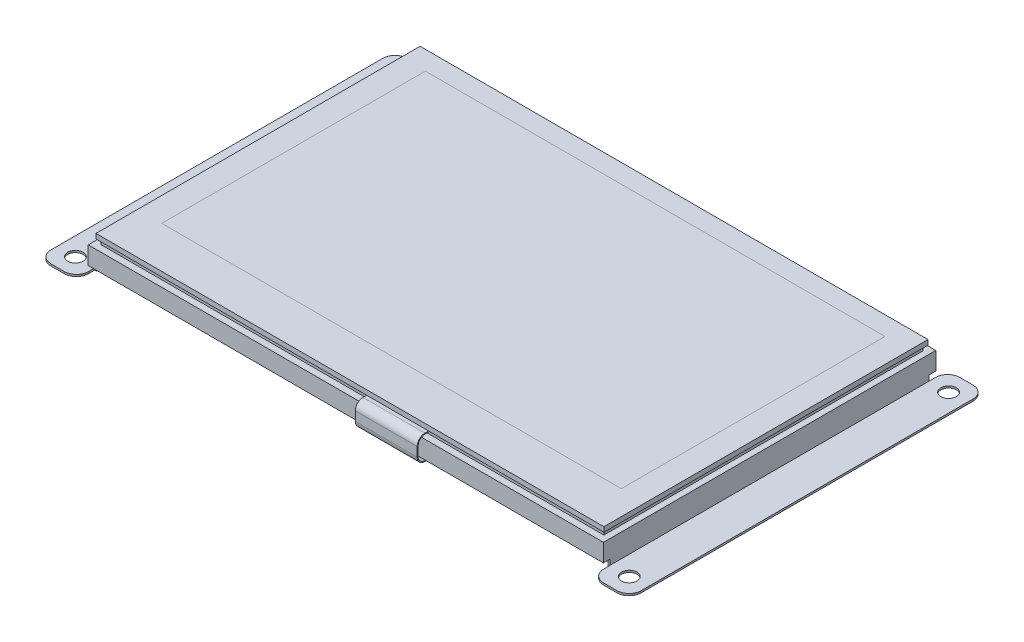
from build123d import *

# Parameters (mm, degrees)
SKETCH_1_W       = 105
SKETCH_1_H       = 67
EXTRUDE_1_DEPTH  = 1
SKETCH_2_W       = 104
SKETCH_2_H       = 66
EXTRUDE_2_DEPTH  = 1
SKETCH_3_W       = 106.5
SKETCH_3_H       = 68.7
EXTRUDE_3_DEPTH  = 3.7
SKETCH_4_W       = 0.4
SKETCH_4_H       = 66
EXTRUDE_4_DEPTH  = 1.5
SKETCH_5_R       = 1.6
EXTRUDE_5_DEPTH  = 0.4
SKETCH_7_W       = 45
SKETCH_7_H       = 38
EXTRUDE_6_DEPTH  = 1.2
SKETCH_8_W       = 7.7
SKETCH_8_H       = 15
EXTRUDE_7_DEPTH  = 5.8
SKETCH_8_3_W     = 8.5
SKETCH_8_3_H     = 8.5
EXTRUDE_8_DEPTH  = 3
SKETCH_8_4_W     = 21
SKETCH_8_4_H     = 4.5
EXTRUDE_9_DEPTH  = 2
SKETCH_8_5_W     = 15
SKETCH_8_5_H     = 15.2
EXTRUDE_10_DEPTH = 2
EXTRUDE_START    = -37.4
EXTRUDE_11_DEPTH = 12.8


with BuildPart() as part:
    # 草圖1 → 填料-伸長1 (new body)
    with BuildSketch(Plane(origin=(0, 0, 0), x_dir=(1, 0, 0), z_dir=(0, 1, 0))):
        Rectangle(SKETCH_1_W, SKETCH_1_H)
    extrude(amount=-EXTRUDE_1_DEPTH)

    # 草圖2 → 填料-伸長2 (add)
    with BuildSketch(Plane.XZ.offset(1)):
        Rectangle(SKETCH_2_W, SKETCH_2_H)
    extrude(amount=EXTRUDE_2_DEPTH)

    # 草圖3 → 填料-伸長3 (add)
    with BuildSketch(Plane.XZ.offset(2)):
        Rectangle(SKETCH_3_W, SKETCH_3_H)
    extrude(amount=EXTRUDE_3_DEPTH)

    # 草圖4 → 填料-伸長4 (add)
    with BuildSketch(Plane.XZ.offset(5.7)):
        with Locations((-53.05, 0)):
            Rectangle(SKETCH_4_W, SKETCH_4_H)
        with Locations((53.05, 0)):
            Rectangle(SKETCH_4_W, SKETCH_4_H)
    extrude(amount=EXTRUDE_4_DEPTH)

    # 草圖5 → 填料-伸長5 (add)
    # profile 1 of 2: a face of its own
    with BuildSketch(Plane.XZ.offset(7.2)):
        with BuildLine():
            Line((-55.75, 36.8), (-58.5, 36.8))
            ThreePointArc((-58.5, 36.8), (-60.267766953, 36.067766953), (-61, 34.3))
            Line((-61, 34.3), (-61, -34.3))
            ThreePointArc((-61, -34.3), (-60.267766953, -36.067766953), (-58.5, -36.8))
            Line((-58.5, -36.8), (-55.75, -36.8))
            ThreePointArc((-55.75, -36.8), (-53.982233047, -36.067766953), (-53.25, -34.3))
            Line((-53.25, -34.3), (-53.25, 34.3))
            ThreePointArc((-53.25, 34.3), (-53.982233047, 36.067766953), (-55.75, 36.8))
        make_face()
        with Locations((-57.25, 33)):
            Circle(SKETCH_5_R, mode=Mode.SUBTRACT)
        with Locations((-57.25, -33)):
            Circle(SKETCH_5_R, mode=Mode.SUBTRACT)
    # profile 2 of 2: a face of its own
    with BuildSketch(Plane.XZ.offset(7.2)):
        with BuildLine():
            Line((61, 34.3), (61, -34.3))
            ThreePointArc((61, -34.3), (60.267766953, -36.067766953), (58.5, -36.8))
            Line((58.5, -36.8), (55.75, -36.8))
            ThreePointArc((55.75, -36.8), (53.982233047, -36.067766953), (53.25, -34.3))
            Line((53.25, -34.3), (53.25, 34.3))
            ThreePointArc((53.25, 34.3), (53.982233047, 36.067766953), (55.75, 36.8))
            Line((55.75, 36.8), (58.5, 36.8))
            ThreePointArc((58.5, 36.8), (60.267766953, 36.067766953), (61, 34.3))
        make_face()
        with Locations((57.25, -33)):
            Circle(SKETCH_5_R, mode=Mode.SUBTRACT)
        with Locations((57.25, 33)):
            Circle(SKETCH_5_R, mode=Mode.SUBTRACT)
    extrude(amount=-EXTRUDE_5_DEPTH)

    # 草圖7 → 填料-伸長6 (add)
    with BuildSketch(Plane.XZ.offset(5.7)):
        with Locations((-3.85, -10.35)):
            Rectangle(SKETCH_7_W, SKETCH_7_H)
    extrude(amount=EXTRUDE_6_DEPTH)

    # 草圖8 → 填料-伸長7 (add)
    with BuildSketch(Plane.XZ.offset(6.9)):
        with Locations((-22.5, -20.85)):
            Rectangle(SKETCH_8_W, SKETCH_8_H)
    extrude(amount=EXTRUDE_7_DEPTH)

    # 草圖8<3> → 填料-伸長8 (add)
    with BuildSketch(Plane.XZ.offset(6.9)):
        with Locations((-21.6, 3.4)):
            Rectangle(SKETCH_8_3_W, SKETCH_8_3_H)
    extrude(amount=EXTRUDE_8_DEPTH)

    # 草圖8<4> → 填料-伸長9 (add)
    with BuildSketch(Plane.XZ.offset(6.9)):
        with Locations((-0.55, 5.9)):
            Rectangle(SKETCH_8_4_W, SKETCH_8_4_H)
    extrude(amount=EXTRUDE_9_DEPTH)

    # 草圖8<5> → 填料-伸長10 (add)
    with BuildSketch(Plane.XZ.offset(6.9)):
        with Locations((14.15, -20.55)):
            Rectangle(SKETCH_8_5_W, SKETCH_8_5_H)
    extrude(amount=EXTRUDE_10_DEPTH)

    # 草圖9 → 填料-伸長11 (add)
    with BuildSketch(Plane(origin=(53.25, 0, 0), x_dir=(0, 0, -1), z_dir=(1, 0, 0)).offset(EXTRUDE_START)):
        with BuildLine():
            Line((-33.85, -6.3), (-29.85, -6.3))
            Line((-29.85, -6.3), (-29.85, -6.5))
            Line((-29.85, -6.5), (-33.85, -6.5))
            ThreePointArc((-33.85, -6.5), (-34.98137085, -6.03137085), (-35.45, -4.9))
            Line((-35.45, -4.9), (-35.45, -3))
            ThreePointArc((-35.45, -3), (-34.98137085, -1.86862915), (-33.85, -1.4))
            Line((-33.85, -1.4), (-33, -1.4))
            Line((-33, -1.4), (-33, -1.6))
            Line((-33, -1.6), (-33.85, -1.6))
            ThreePointArc((-33.85, -1.6), (-34.839949494, -2.010050506), (-35.25, -3))
            Line((-35.25, -3), (-35.25, -4.9))
            ThreePointArc((-35.25, -4.9), (-34.839949494, -5.889949494), (-33.85, -6.3))
        make_face()
    extrude(amount=-EXTRUDE_11_DEPTH)


solid = part.part
